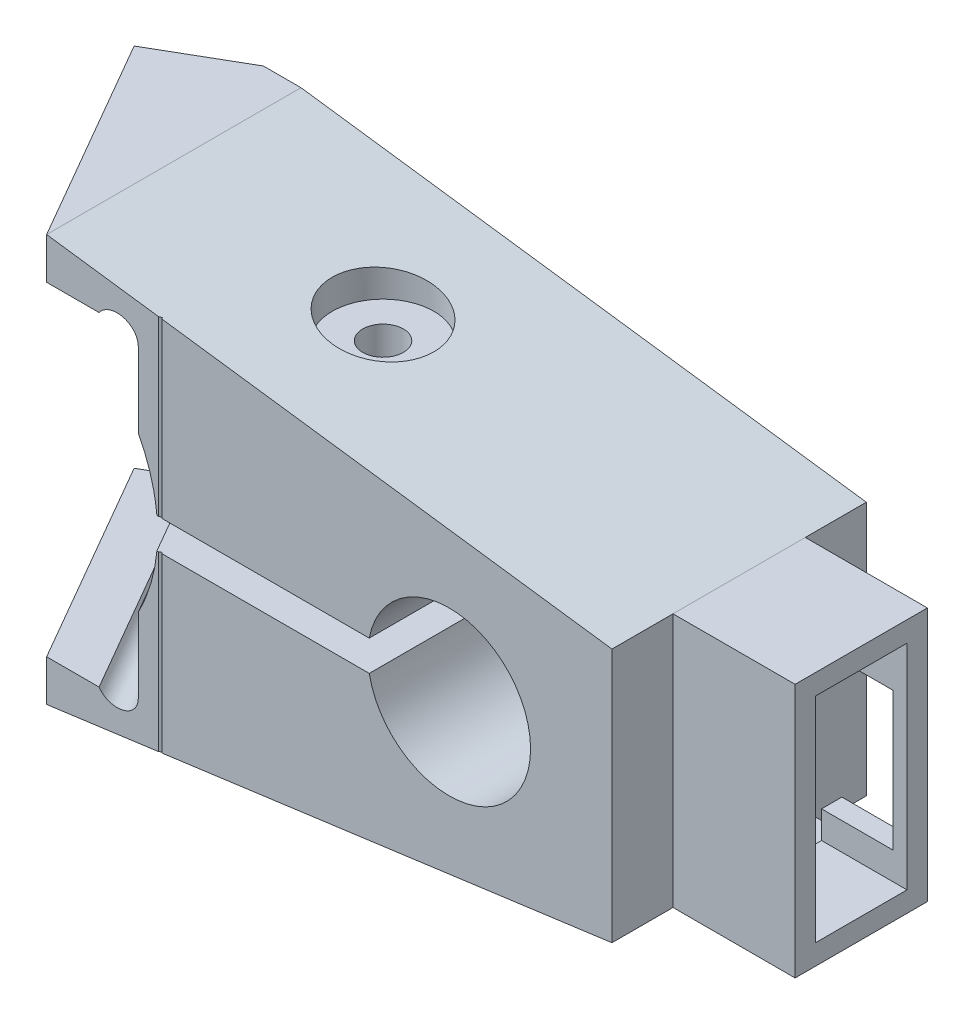
from build123d import *

# Parameters (mm, degrees)
BOSS_EXTRUDE1_DEPTH     = 40
CUT_EXTRUDE1_DEPTH      = 40
SKETCH3_W               = 4.376715803
SKETCH3_H               = 7.921330006
BOSS_EXTRUDE2_DEPTH     = 40
CUT_EXTRUDE2_DEPTH      = 78.145313728
CUT_EXTRUDE2_DEPTH_BACK = 78.145313728
CUT_EXTRUDE3_DEPTH      = 40
CUT_EXTRUDE4_DEPTH      = 43.935998882
CUT_EXTRUDE4_DEPTH_BACK = 43.935998882
SKETCH6_R               = 2
CUT_EXTRUDE5_DEPTH      = 5
SKETCH8_R               = 5
CUT_EXTRUDE6_DEPTH      = 5
CUT_EXTRUDE7_START      = -2
SKETCH9_W               = 6.222682415
SKETCH9_H               = 53.403341902
CUT_EXTRUDE7_DEPTH      = 16
SKETCH10_W              = 13
SKETCH10_H              = 25
SKETCH10_W_2            = 9
SKETCH10_H_2            = 21
BOSS_EXTRUDE3_DEPTH     = 12
CUT_EXTRUDE8_DEPTH      = 11


with BuildPart() as part:
    # Sketch1 → Boss-Extrude1 (new body)
    with BuildSketch(Plane(origin=(0, 0, 0), x_dir=(1, 0, 0), z_dir=(0, 1, 0))):
        Polygon((-35, 12.5), (-20.56624327, -12.5), (35, -12.5), (35, 12.5), align=None)
    extrude(amount=BOSS_EXTRUDE1_DEPTH)

    # Sketch2 → Cut-Extrude1 (cut)
    with BuildSketch(Plane.XY.offset(12.5)):
        Polygon((-20.56624327, 40), (35, 32.5), (35, 40), align=None)
        Polygon((35, 7.5), (-20.56624327, 0), (35, 0), align=None)
    extrude(amount=-CUT_EXTRUDE1_DEPTH, mode=Mode.SUBTRACT)

    # Sketch3 → Boss-Extrude2 (add)
    with BuildSketch(Plane(origin=(-20.837341226, 0, 12.030444566), x_dir=(0.4999999999999981, 0, 0.8660254037844397), z_dir=(-0.8660254037844398, 0, 0.4999999999999982))):
        with Locations((-10.675795445, 21.421253709)):
            Rectangle(SKETCH3_W, SKETCH3_H)
    extrude(amount=BOSS_EXTRUDE2_DEPTH)

    # Sketch4 → Cut-Extrude2 (cut, two sides: drawn at the far end of the back side and taken through both)
    with BuildSketch(Plane(origin=(-4.243718771, 0, -7.350336525), x_dir=(0.8660254037844397, 0, -0.4999999999999983), z_dir=(0.4999999999999982, 0, 0.8660254037844396)).offset(-CUT_EXTRUDE2_DEPTH_BACK)):
        with BuildLine():
            Line((-25.260889132, 35.934120187), (-19.597573928, 35.934120187))
            ThreePointArc((-19.597573928, 35.934120187), (-17.574079433, 36.729704946), (-16.260889132, 34.996783621))
            Line((-16.260889132, 34.996783621), (-16.260889132, 27.623217913))
            ThreePointArc((-16.260889132, 27.623217913), (-14.610889132, 19.996783621), (-16.260889132, 12.37034933))
            Line((-16.260889132, 12.37034933), (-16.260889132, 4.996783621))
            ThreePointArc((-16.260889132, 4.996783621), (-17.574079433, 3.263862297), (-19.597573928, 4.059447055))
            Line((-19.597573928, 4.059447055), (-25.260889132, 4.059447055))
            Line((-25.260889132, 4.059447055), (-25.260889132, 11.549622397))
            Line((-25.260889132, 11.549622397), (-69.354192402, 11.549622397))
            Line((-69.354192402, 11.549622397), (-69.354192402, 27.546843348))
            Line((-69.354192402, 27.546843348), (-25.260889132, 26.613076168))
            Line((-25.260889132, 26.613076168), (-25.260889132, 35.934120187))
        make_face()
    extrude(amount=CUT_EXTRUDE2_DEPTH + CUT_EXTRUDE2_DEPTH_BACK, mode=Mode.SUBTRACT)

    # Sketch5 → Cut-Extrude3 (cut)
    with BuildSketch(Plane(origin=(0, 0, -12.5), x_dir=(-1, 0, 0), z_dir=(0, 0, -1))):
        with BuildLine():
            Line((-11.141275202, 21.5), (29.874932975, 21.5))
            Line((29.874932975, 21.5), (29.874932975, 18.5))
            Line((29.874932975, 18.5), (-11.142492493, 18.5))
            ThreePointArc((-11.142492493, 18.5), (-26.999999341, 20.006434648), (-11.141275202, 21.5))
        make_face()
    extrude(amount=-CUT_EXTRUDE3_DEPTH, mode=Mode.SUBTRACT)

    # Sketch6 → Cut-Extrude4 (cut, two sides: drawn at the far end of the back side and taken through both)
    with BuildSketch(Plane(origin=(0, 18.5, 0), x_dir=(1, 0, 0), z_dir=(0, 1, 0)).offset(-CUT_EXTRUDE4_DEPTH_BACK)):
        Circle(SKETCH6_R)
    extrude(amount=CUT_EXTRUDE4_DEPTH + CUT_EXTRUDE4_DEPTH_BACK, mode=Mode.SUBTRACT)

    # Sketch7 → Cut-Extrude5 (cut)
    with BuildSketch(Plane.XZ):
        Polygon((1.8525736, 3.461402084), (-2.071375338, 3.335076842), (-3.923948938, -0.126325242), (-1.8525736, -3.461402084), (2.071375338, -3.335076842), (3.923948938, 0.126325242), align=None)
    extrude(amount=-CUT_EXTRUDE5_DEPTH, mode=Mode.SUBTRACT)

    # Sketch8 → Cut-Extrude6 (cut)
    with BuildSketch(Plane(origin=(0, 40, 0), x_dir=(1, 0, 0), z_dir=(0, 1, 0))):
        with Locations(Location((0, 0, 0), (0, 0, 270))):
            Circle(SKETCH8_R)
    extrude(amount=-CUT_EXTRUDE6_DEPTH, mode=Mode.SUBTRACT)

    # Sketch9 → Cut-Extrude7 (cut)
    with BuildSketch(Plane(origin=(-14.082343077, 0, 8.130444566), x_dir=(0.4999999999999982, 0, 0.8660254037844397), z_dir=(-0.8660254037844398, 0, 0.4999999999999983)).offset(CUT_EXTRUDE7_START)):
        with Locations((-26.065813196, 19.047949313)):
            Rectangle(SKETCH9_W, SKETCH9_H)
        Polygon((6.045528012, 45.749620264), (6.045528012, -7.653721638), (13.717164193, -7.653721638), (13.717164193, 42.686575292), (13.717164193, 45.749620264), align=None)
    extrude(amount=CUT_EXTRUDE7_DEPTH, mode=Mode.SUBTRACT)

    # Sketch10 → Boss-Extrude3 (add)
    with BuildSketch(Plane(origin=(35, 0, 0), x_dir=(0, 0, -1), z_dir=(1, 0, 0))):
        with Locations((0, 20)):
            Rectangle(SKETCH10_W, SKETCH10_H)
        with Locations((0, 20)):
            Rectangle(SKETCH10_W_2, SKETCH10_H_2, mode=Mode.SUBTRACT)
    extrude(amount=BOSS_EXTRUDE3_DEPTH)

    # Sketch11 → Cut-Extrude8 (cut)
    with BuildSketch(Plane(origin=(0, 0, -6.5), x_dir=(-1, 0, 0), z_dir=(0, 0, -1))):
        Polygon((-38.6, 30.8), (-35, 30.8), (-35, 25.8), (-35, 12.2), (-35, 9.2), (-38.6, 9.2), (-38.6, 12.2), (-45.6, 12.2), (-45.6, 25.8), (-38.6, 25.8), align=None)
    extrude(amount=-CUT_EXTRUDE8_DEPTH, mode=Mode.SUBTRACT)


solid = part.part
